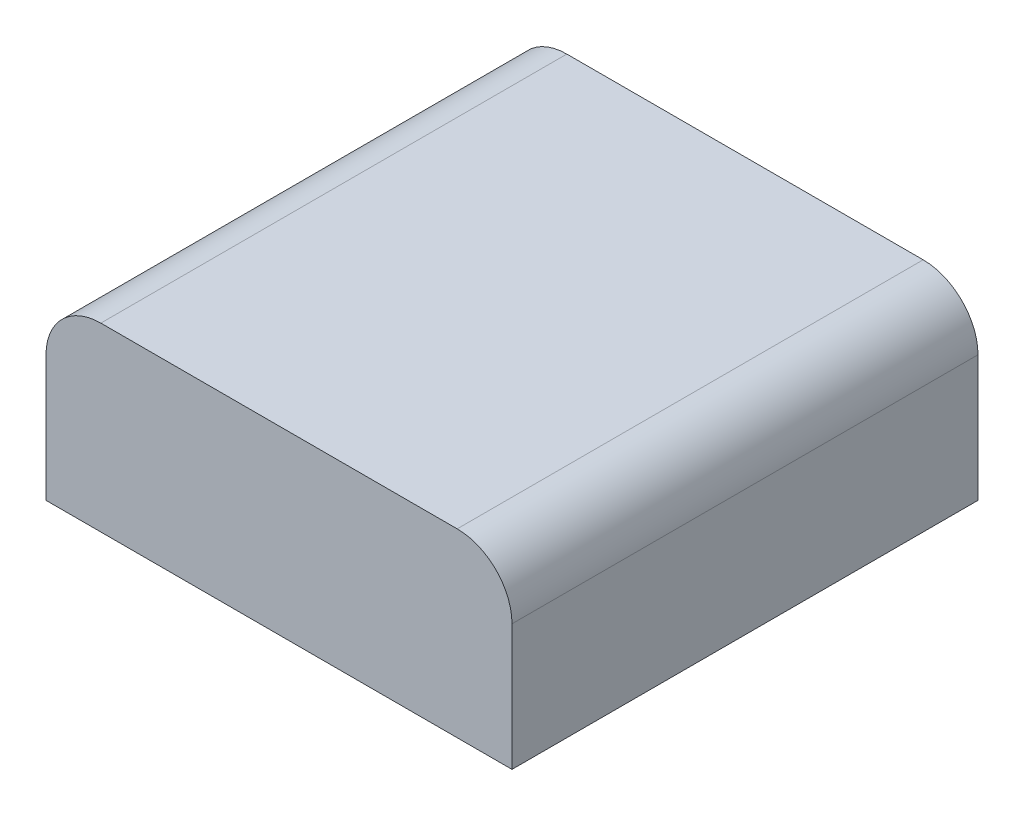
from build123d import *

# Parameters (mm, degrees)
BOSS_EXTRUDE1_DEPTH = 42.5
SHELL1_T            = -2


with BuildPart() as part:
    # Sketch3 → Boss-Extrude1 (new, symmetric)
    with BuildSketch(Plane.XY):
        with BuildLine():
            Line((-32.5, 16.5), (32.5, 16.5))
            ThreePointArc((32.5, 16.5), (39.571067812, 13.571067812), (42.5, 6.5))
            Line((42.5, 6.5), (42.5, -16.5))
            Line((42.5, -16.5), (-42.5, -16.5))
            Line((-42.5, -16.5), (-42.5, 6.5))
            ThreePointArc((-42.5, 6.5), (-39.571067812, 13.571067812), (-32.5, 16.5))
        make_face()
    extrude(amount=BOSS_EXTRUDE1_DEPTH, both=True)

    # Shell1
    shell1_openings = [part.faces().sort_by_distance(p)[0] for p in [
        (0, -16.5, 0),
    ]]
    offset(amount=SHELL1_T, openings=shell1_openings, kind=Kind.INTERSECTION)


solid = part.part
